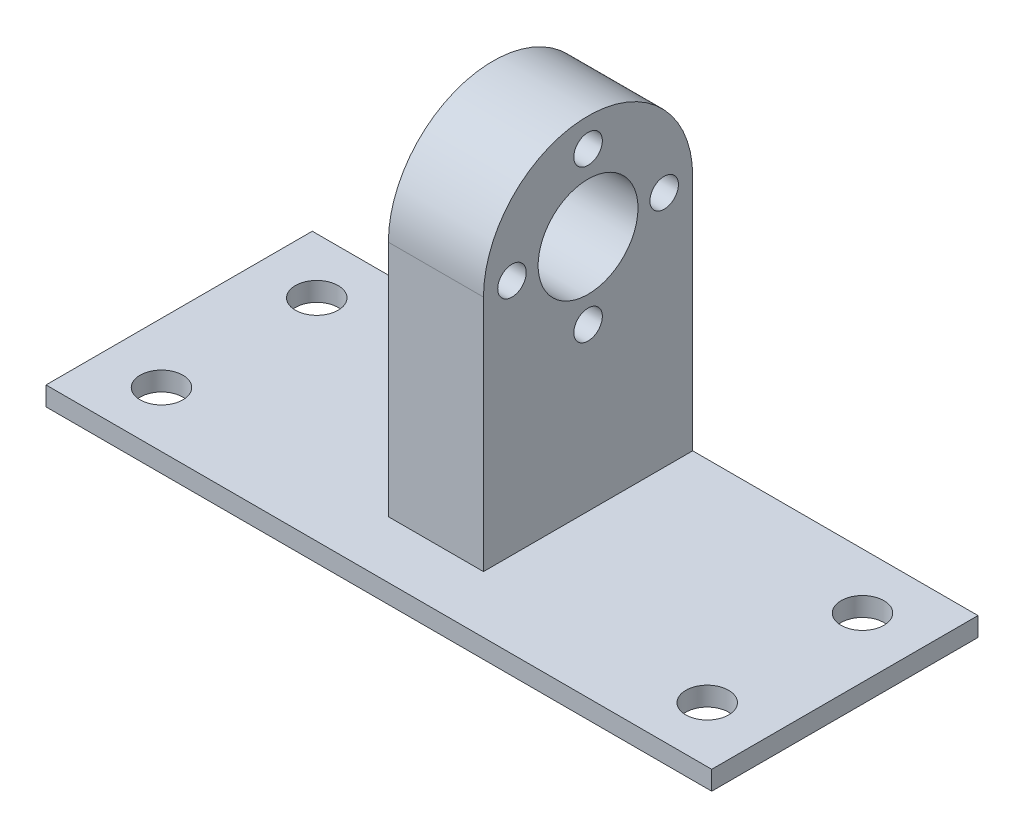
from build123d import *

# Parameters (mm, degrees)
SKETCH1_W                = 70
SKETCH1_H                = 28
BOSS_EXTRUDE1_DEPTH      = 2
SKETCH2_R                = 11
SKETCH2_R_2              = 5.25
BOSS_EXTRUDE2_DEPTH      = 5
BOSS_EXTRUDE3_REACH      = 54.125
BOSS_EXTRUDE3_END_RADIUS = 11
SKETCH3_W                = 10
SKETCH3_H                = 22
SKETCH5_R                = 2.25
CUT_EXTRUDE1_DEPTH       = 53.12485012
MIRROR2_COPY_1_SKETCH_R  = 2.25
MIRROR2_COPY_1_DEPTH     = 53.12485012
SKETCH6_R                = 1.5
CUT_EXTRUDE2_DEPTH       = 57.920997883


with BuildPart() as part:
    # Sketch1 → Boss-Extrude1 (new body)
    with BuildSketch(Plane(origin=(0, 0, 0), x_dir=(1, 0, 0), z_dir=(0, 1, 0))):
        Rectangle(SKETCH1_W, SKETCH1_H)
    extrude(amount=BOSS_EXTRUDE1_DEPTH)



with BuildPart() as body_2:
    # Sketch2 → Boss-Extrude2 (new, symmetric)
    with BuildSketch(Plane(origin=(0, 0, 0), x_dir=(0, 0, -1), z_dir=(1, 0, 0))):
        with Locations((3, 27)):
            Circle(SKETCH2_R)
        with Locations((3, 27)):
            Circle(SKETCH2_R_2, mode=Mode.SUBTRACT)
    extrude(amount=BOSS_EXTRUDE2_DEPTH, both=True)


with BuildPart() as part_1:
    add(part.part)

    add(body_2.part)  # Boss-Extrude3 merges body 2
    # Boss-Extrude3: up to this cylinder (the profile starts outside it)
    boss_extrude3_end = Plane(origin=(0, 27, -3), z_dir=(-1, 0, 0)) * Cylinder(BOSS_EXTRUDE3_END_RADIUS, 131.25, mode=Mode.PRIVATE)
    # Sketch3 → Boss-Extrude3 (add, up to the surface)
    with BuildSketch(Plane(origin=(0, 2, 0), x_dir=(1, 0, 0), z_dir=(0, 1, 0)), mode=Mode.PRIVATE) as boss_extrude3_sk1:
        with Locations((0, 3)):
            Rectangle(SKETCH3_W, SKETCH3_H)
    boss_extrude3_tool1 = extrude(boss_extrude3_sk1.sketch, amount=BOSS_EXTRUDE3_REACH, mode=Mode.PRIVATE) - boss_extrude3_end
    add(boss_extrude3_tool1.solids().sort_by_distance((0, 2, -3))[0])

    # Sketch5 → Cut-Extrude1 (cut, through all)
    with BuildSketch(Plane(origin=(0, 2, 0), x_dir=(1, 0, 0), z_dir=(0, 1, 0))):
        with Locations(Location((-28.692400687, 8.162233715, 0), (0, 0, 270))):
            Circle(SKETCH5_R)
    cut_extrude1 = extrude(amount=-CUT_EXTRUDE1_DEPTH, mode=Mode.SUBTRACT)

    # Mirror1: Cut-Extrude1 across plane
    add(cut_extrude1.mirror(Plane(origin=(0, 0, 0), x_dir=(1, 0, 0), z_dir=(0, 0, -1))), mode=Mode.SUBTRACT)

    # Mirror2: Cut-Extrude1 across plane
    add(cut_extrude1.mirror(Plane.ZY), mode=Mode.SUBTRACT)

    # Mirror2 copy 1 sketch → Mirror2 copy 1 (cut, through all)
    with BuildSketch(Plane(origin=(0, 2, 0), x_dir=(-1, 0, 0), z_dir=(0, 1, 0))):
        with Locations(Location((-28.692400687, 8.162233715, 0), (0, 0, 270))):
            Circle(MIRROR2_COPY_1_SKETCH_R)
    extrude(amount=-MIRROR2_COPY_1_DEPTH, mode=Mode.SUBTRACT)

    # Sketch6 → Cut-Extrude2 (cut, through all)
    with BuildSketch(Plane.ZY.offset(5)):
        with Locations((-3, 35)):
            Circle(SKETCH6_R)
        with Locations((-11, 27)):
            Circle(SKETCH6_R)
        with Locations((5, 27)):
            Circle(SKETCH6_R)
        with Locations((-3, 19)):
            Circle(SKETCH6_R)
    extrude(amount=-CUT_EXTRUDE2_DEPTH, mode=Mode.SUBTRACT)


solid = part_1.part
